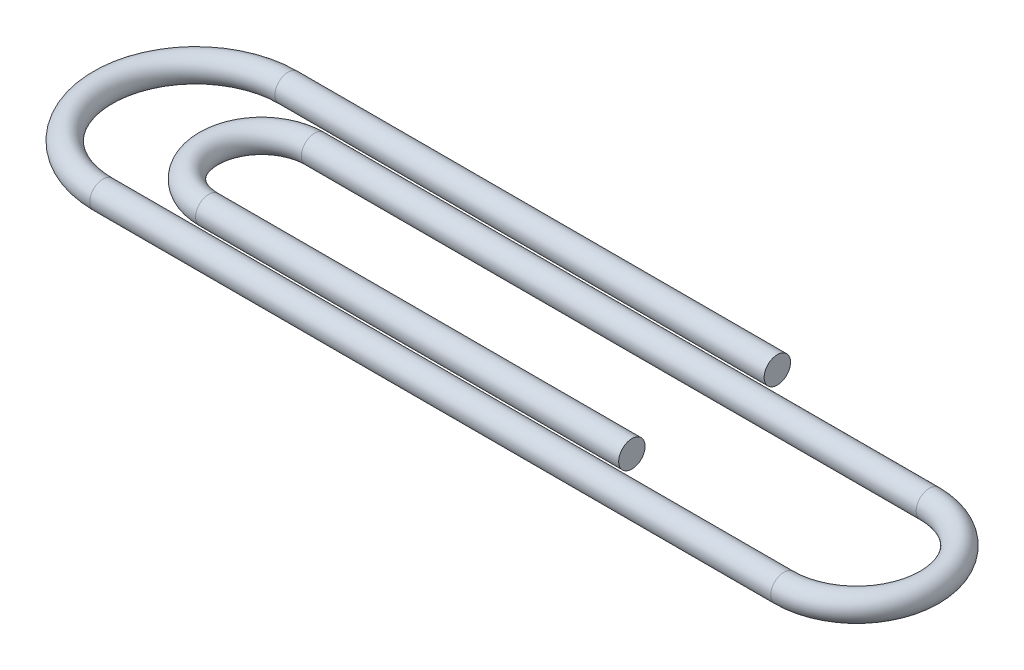
from build123d import *

# Parameters (mm, degrees)
SKETCH3_R = 0.5


with BuildPart() as part:
    # Sweep1: sweep along a path in Sketch1
    with BuildLine(Plane(origin=(0, 0, 0), x_dir=(1, 0, 0), z_dir=(0, 1, 0))) as sweep1_path:
        Line((0, 0), (-16, 0))
        ThreePointArc((-16, 0), (-18, 2), (-16, 4))
        Line((-16, 4), (7.25, 4))
        ThreePointArc((7.25, 4), (10, 1.25), (7.25, -1.5))
        Line((7.25, -1.5), (-18.5, -1.5))
        ThreePointArc((-18.5, -1.5), (-22, 2), (-18.5, 5.5))
        Line((-18.5, 5.5), (0, 5.5))
    # Sketch3 → Sweep1 (sweep)
    with BuildSketch(Plane(origin=(0, 0, 0), x_dir=(0, 0, -1), z_dir=(1, 0, 0))):
        Circle(SKETCH3_R)
    sweep(path=sweep1_path.line)


solid = part.part
